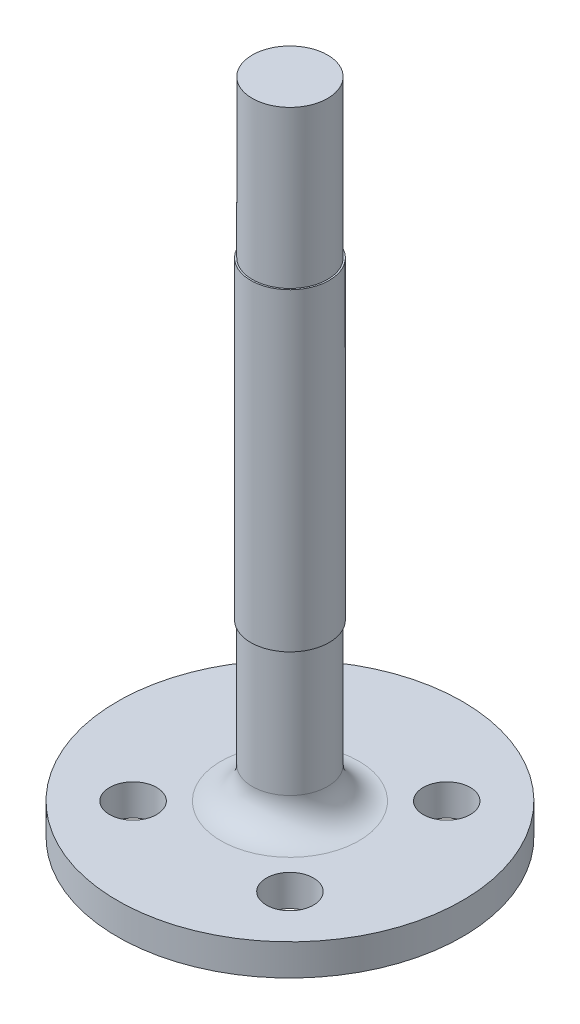
from build123d import *

# Parameters (mm, degrees)
SKETCH_1_R      = 2.4
EXTRUDE_1_DEPTH = 40
SKETCH_2_R      = 2.5
EXTRUDE_2_DEPTH = 10
SKETCH_3_R      = 11
SKETCH_3_R_2    = 1.5
SKETCH_3_R_3    = 2.4
EXTRUDE_3_DEPTH = 2


with BuildPart() as part:
    # 草图1 → 凸台-拉伸1 (new body)
    with BuildSketch(Plane(origin=(0, 0, 0), x_dir=(1, 0, 0), z_dir=(0, 1, 0))):
        with Locations(Location((0, 0, 0), (0, 0, 270))):
            Circle(SKETCH_1_R)
    extrude(amount=EXTRUDE_1_DEPTH)

    # 草图2 → 凸台-拉伸2 (add, symmetric)
    with BuildSketch(Plane(origin=(0, 20, 0), x_dir=(-1, 0, 0), z_dir=(0, -1, 0))):
        with Locations(Location((0, 0, 0), (0, 0, 90))):
            Circle(SKETCH_2_R)
    extrude(amount=EXTRUDE_2_DEPTH, both=True)



with BuildPart() as body_2:
    # 草图3 → 凸台-拉伸3 (new body)
    with BuildSketch(Plane.XZ):
        with Locations(Location((0, 0, 0), (0, 0, 270))):
            Circle(SKETCH_3_R)
        with Locations(Location((-5, -5, 0), (0, 0, 270))):
            Circle(SKETCH_3_R_2, mode=Mode.SUBTRACT)
        with Locations(Location((-5, 5, 0), (0, 0, 270))):
            Circle(SKETCH_3_R_2, mode=Mode.SUBTRACT)
        with Locations(Location((5, 5, 0), (0, 0, 270))):
            Circle(SKETCH_3_R_2, mode=Mode.SUBTRACT)
        with Locations(Location((5, -5, 0), (0, 0, 270))):
            Circle(SKETCH_3_R_2, mode=Mode.SUBTRACT)
        with Locations(Location((0, 0, 0), (0, 0, 270))):
            Circle(SKETCH_3_R_3, mode=Mode.SUBTRACT)
    extrude(amount=EXTRUDE_3_DEPTH)


with BuildPart() as part_1:
    add(part.part)

    add(body_2.part)  # 旋转3 merges body 2
    # 草图4 → 旋转3 (revolve)
    with BuildSketch(Plane(origin=(0, 0, 0), x_dir=(0, 0, -1), z_dir=(1, 0, 0)), mode=Mode.PRIVATE) as revolve_3_sk:
        with BuildLine():
            Line((-2.4, 0), (-4.4, 0))
            ThreePointArc((-4.4, 0), (-2.985786438, 0.585786438), (-2.4, 2))
            Line((-2.4, 2), (-2.4, 0))
        make_face()
    revolve(revolve_3_sk.sketch.rotate(Axis((0, -1000, 0), (0, 1, 0)), 180), axis=Axis((0, -1000, 0), (0, 1, 0)))


solid = part_1.part
